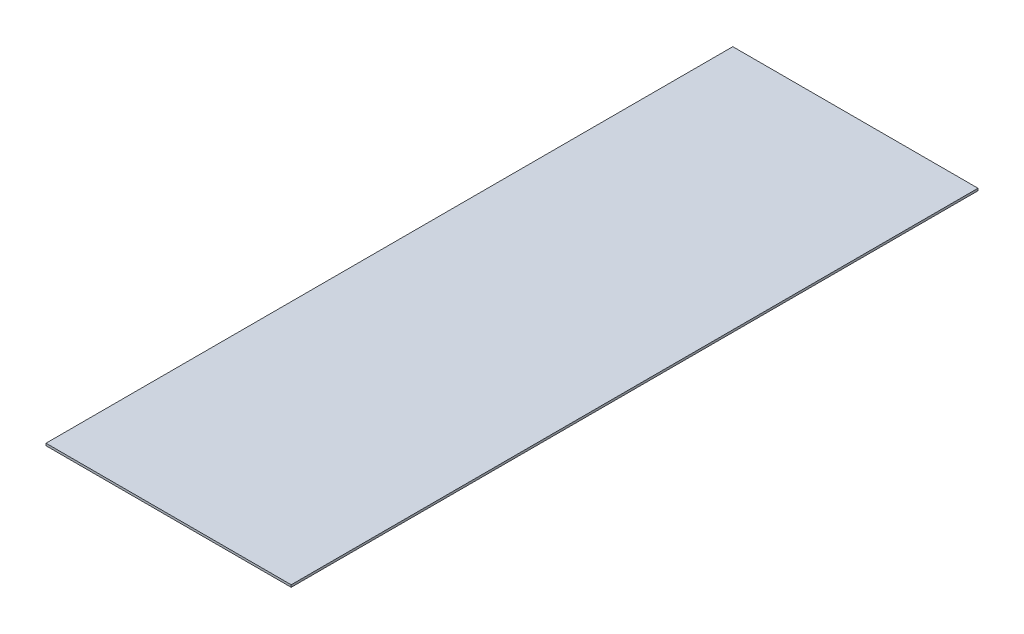
from build123d import *

# Parameters (mm, degrees)
SKETCH1_W           = 440
SKETCH1_H           = 1232.5
BOSS_EXTRUDE1_DEPTH = 2


with BuildPart() as part:
    # Sketch1 → Boss-Extrude1 (new, symmetric)
    with BuildSketch(Plane(origin=(0, 0, 0), x_dir=(1, 0, 0), z_dir=(0, 1, 0))):
        Rectangle(SKETCH1_W, SKETCH1_H)
    extrude(amount=BOSS_EXTRUDE1_DEPTH, both=True)


solid = part.part
